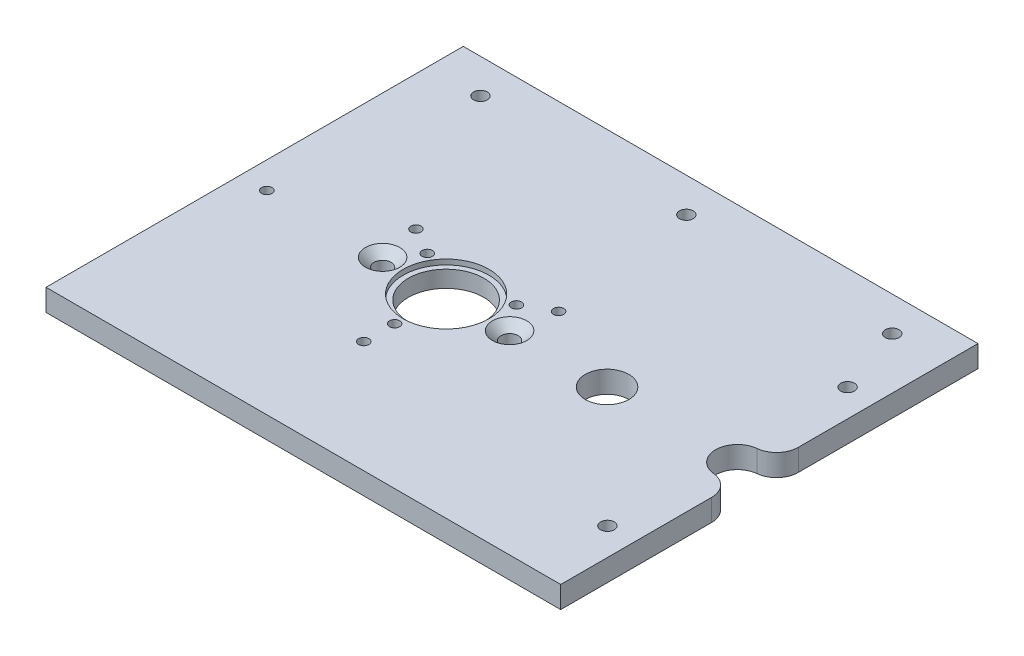
from build123d import *

# Parameters (mm, degrees)
CROQUIS1_W              = 150
CROQUIS1_H              = 101.6
SALIENTE_EXTRUIR1_DEPTH = 3.175
CROQUIS2_R              = 2
CROQUIS2_R_2            = 11
CROQUIS2_R_3            = 1.5
CROQUIS2_R_4            = 6.35
CORTAR_EXTRUIR1_DEPTH   = 91.807282197
REDONDEO1_R             = 6.35
CROQUIS3_R              = 1.5
CORTAR_EXTRUIR2_DEPTH   = 91.807282197
CORTAR_EXTRUIR3_START   = 3.175
CROQUIS4_R              = 12.5
CORTAR_EXTRUIR3_DEPTH   = 1.5
CROQUIS9_R              = 2.5
CORTAR_EXTRUIR6_DEPTH   = 91.807282197
CHAFL_N1_SIZE           = 2.5
CROQUIS10_W             = 150
CROQUIS10_H             = 20
CROQUIS10_R             = 2
SALIENTE_EXTRUIR2_DEPTH = 6.35


with BuildPart() as part:
    # Croquis1 → Saliente-Extruir1 (new, symmetric)
    with BuildSketch(Plane(origin=(0, 0, 0), x_dir=(1, 0, 0), z_dir=(0, 1, 0))):
        Rectangle(CROQUIS1_W, CROQUIS1_H)
    extrude(amount=SALIENTE_EXTRUIR1_DEPTH, both=True)

    # Croquis2 → Cortar-Extruir1 (cut, through all)
    with BuildSketch(Plane(origin=(0, 3.175, 0), x_dir=(1, 0, 0), z_dir=(0, 1, 0))):
        with Locations(Location((67, 40.8, 0), (0, 0, 270))):
            Circle(CROQUIS2_R)
        with Locations(Location((67, -29.2, 0), (0, 0, 90))):
            Circle(CROQUIS2_R)
        with Locations(Location((-15, 5.8, 0), (0, 0, 270))):
            Circle(CROQUIS2_R_2)
        with Locations(Location((-67.25, 5.8, 0), (0, 0, 270))):
            Circle(CROQUIS2_R_3)
        with Locations(Location((31.9, 5.8, 0), (0, 0, 270))):
            Circle(CROQUIS2_R_4)
        with Locations((69.9, 5.8)):
            Circle(CROQUIS2_R_4)
    extrude(amount=-CORTAR_EXTRUIR1_DEPTH, mode=Mode.SUBTRACT)

    # Redondeo1
    redondeo1_edges = [part.edges().sort_by_distance(p)[0] for p in [
        (75, 0, -2.016813512),
        (75, 0, -9.583186488),
    ]]
    fillet(redondeo1_edges, radius=REDONDEO1_R)

    # Croquis3 → Cortar-Extruir2 (cut, through all)
    with BuildSketch(Plane(origin=(0, 3.175, 0), x_dir=(1, 0, 0), z_dir=(0, 1, 0))):
        with Locations(Location((-15, -9.2, 0), (0, 0, 270))):
            Circle(CROQUIS3_R)
        with Locations(Location((-15, -18.2, 0), (0, 0, 270))):
            Circle(CROQUIS3_R)
        with Locations(Location((-27.990381057, 13.3, 0), (0, 0, 270))):
            Circle(CROQUIS3_R)
        with Locations(Location((-35.784609691, 17.8, 0), (0, 0, 270))):
            Circle(CROQUIS3_R)
        with Locations(Location((-2.009618943, 13.3, 0), (0, 0, 270))):
            Circle(CROQUIS3_R)
        with Locations(Location((5.784609691, 17.8, 0), (0, 0, 270))):
            Circle(CROQUIS3_R)
    extrude(amount=-CORTAR_EXTRUIR2_DEPTH, mode=Mode.SUBTRACT)

    # Croquis4 → Cortar-Extruir3 (cut)
    with BuildSketch(Plane(origin=(0, 0, 0), x_dir=(1, 0, 0), z_dir=(0, 1, 0)).offset(CORTAR_EXTRUIR3_START)):
        with Locations(Location((-15, 5.8, 0), (0, 0, 270))):
            Circle(CROQUIS4_R)
    extrude(amount=-CORTAR_EXTRUIR3_DEPTH, mode=Mode.SUBTRACT)

    # Croquis9 → Cortar-Extruir6 (cut, through all)
    with BuildSketch(Plane(origin=(0, 3.175, 0), x_dir=(1, 0, 0), z_dir=(0, 1, 0))):
        with Locations(Location((3.5, 5.8, 0), (0, 0, 270))):
            Circle(CROQUIS9_R)
        with Locations(Location((-33.5, 5.8, 0), (0, 0, 90))):
            Circle(CROQUIS9_R)
    extrude(amount=-CORTAR_EXTRUIR6_DEPTH, mode=Mode.SUBTRACT)

    # Chaflán1
    chafl_n1_edges = [part.edges().sort_by_distance(p)[0] for p in [
        (3.5, 3.175, -8.3),
        (-33.5, 3.175, -3.3),
    ]]
    chamfer(chafl_n1_edges, length=CHAFL_N1_SIZE)

    # Croquis10 → Saliente-Extruir2 (add)
    with BuildSketch(Plane(origin=(0, 3.175, 0), x_dir=(1, 0, 0), z_dir=(0, 1, 0))):
        with Locations((0, 60.8)):
            Rectangle(CROQUIS10_W, CROQUIS10_H)
        with Locations(Location((0, 60.8, 0), (0, 0, 270))):
            Circle(CROQUIS10_R, mode=Mode.SUBTRACT)
        with Locations(Location((-60, 60.8, 0), (0, 0, 270))):
            Circle(CROQUIS10_R, mode=Mode.SUBTRACT)
        with Locations(Location((60, 60.8, 0), (0, 0, 270))):
            Circle(CROQUIS10_R, mode=Mode.SUBTRACT)
    extrude(amount=-SALIENTE_EXTRUIR2_DEPTH)


solid = part.part
